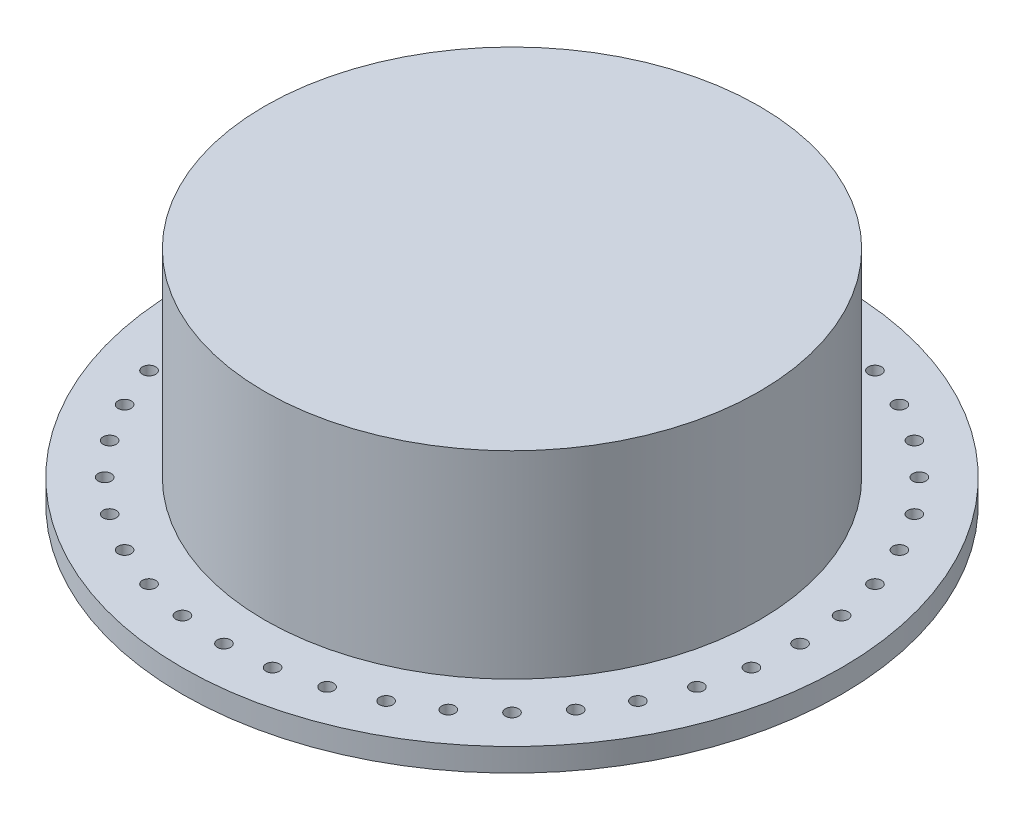
from build123d import *

# Parameters (mm, degrees)
SKIZZE1_R                       = 75
AUFSATZ_LINEAR_AUSTRAGEN1_DEPTH = 10
SKIZZE2_R                       = 100
AUFSATZ_LINEAR_AUSTRAGEN2_DEPTH = 7
SKIZZE3_R                       = 75
AUFSATZ_LINEAR_AUSTRAGEN3_DEPTH = 60
SKIZZE4_R                       = 2
SCHNITT_LINEAR_AUSTRAGEN1_DEPTH = 60


with BuildPart() as part:
    # Skizze1 → Aufsatz-Linear austragen1 (new body)
    with BuildSketch(Plane(origin=(0, 0, 0), x_dir=(1, 0, 0), z_dir=(0, 1, 0))):
        with Locations(Location((0, 0, 0), (0, 0, 270))):
            Circle(SKIZZE1_R)
    extrude(amount=AUFSATZ_LINEAR_AUSTRAGEN1_DEPTH)

    # Skizze2 → Aufsatz-Linear austragen2 (add)
    with BuildSketch(Plane(origin=(0, 10, 0), x_dir=(1, 0, 0), z_dir=(0, 1, 0))):
        with Locations(Location((0, 0, 0), (0, 0, 270))):
            Circle(SKIZZE2_R)
    extrude(amount=AUFSATZ_LINEAR_AUSTRAGEN2_DEPTH)

    # Skizze3 → Aufsatz-Linear austragen3 (add)
    with BuildSketch(Plane(origin=(0, 17, 0), x_dir=(1, 0, 0), z_dir=(0, 1, 0))):
        with Locations(Location((0, 0, 0), (0, 0, 270))):
            Circle(SKIZZE3_R)
    extrude(amount=AUFSATZ_LINEAR_AUSTRAGEN3_DEPTH)

    # Skizze4 → Schnitt-Linear austragen1 (cut)
    with BuildSketch(Plane(origin=(0, 17, 0), x_dir=(1, 0, 0), z_dir=(0, 1, 0))):
        with Locations(Location((0, 87.36395499, 0), (0, 0, 270))):
            Circle(SKIZZE4_R)
        with Locations(Location((13.666733563, 86.288359732, 0), (0, 0, 270))):
            Circle(SKIZZE4_R)
        with Locations(Location((26.996946788, 83.088058682, 0), (0, 0, 270))):
            Circle(SKIZZE4_R)
        with Locations(Location((39.662405585, 77.841853875, 0), (0, 0, 270))):
            Circle(SKIZZE4_R)
        with Locations(Location((51.351244325, 70.678924283, 0), (0, 0, 270))):
            Circle(SKIZZE4_R)
        with Locations(Location((61.775645005, 61.775645005, 0), (0, 0, 270))):
            Circle(SKIZZE4_R)
        with Locations(Location((70.678924283, 51.351244325, 0), (0, 0, 270))):
            Circle(SKIZZE4_R)
        with Locations(Location((77.841853875, 39.662405585, 0), (0, 0, 270))):
            Circle(SKIZZE4_R)
        with Locations(Location((83.088058682, 26.996946788, 0), (0, 0, 270))):
            Circle(SKIZZE4_R)
        with Locations(Location((86.288359732, 13.666733563, 0), (0, 0, 270))):
            Circle(SKIZZE4_R)
        with Locations(Location((87.36395499, 0, 0), (0, 0, 270))):
            Circle(SKIZZE4_R)
        with Locations(Location((86.288359732, -13.666733563, 0), (0, 0, 270))):
            Circle(SKIZZE4_R)
        with Locations(Location((83.088058682, -26.996946788, 0), (0, 0, 270))):
            Circle(SKIZZE4_R)
        with Locations(Location((77.841853875, -39.662405585, 0), (0, 0, 270))):
            Circle(SKIZZE4_R)
        with Locations(Location((70.678924283, -51.351244325, 0), (0, 0, 270))):
            Circle(SKIZZE4_R)
        with Locations(Location((61.775645005, -61.775645005, 0), (0, 0, 270))):
            Circle(SKIZZE4_R)
        with Locations(Location((51.351244325, -70.678924283, 0), (0, 0, 270))):
            Circle(SKIZZE4_R)
        with Locations(Location((39.662405585, -77.841853875, 0), (0, 0, 270))):
            Circle(SKIZZE4_R)
        with Locations(Location((26.996946788, -83.088058682, 0), (0, 0, 270))):
            Circle(SKIZZE4_R)
        with Locations(Location((13.666733563, -86.288359732, 0), (0, 0, 270))):
            Circle(SKIZZE4_R)
        with Locations(Location((0, -87.36395499, 0), (0, 0, 270))):
            Circle(SKIZZE4_R)
        with Locations(Location((-13.666733563, -86.288359732, 0), (0, 0, 270))):
            Circle(SKIZZE4_R)
        with Locations(Location((-26.996946788, -83.088058682, 0), (0, 0, 270))):
            Circle(SKIZZE4_R)
        with Locations(Location((-39.662405585, -77.841853875, 0), (0, 0, 270))):
            Circle(SKIZZE4_R)
        with Locations(Location((-51.351244325, -70.678924283, 0), (0, 0, 270))):
            Circle(SKIZZE4_R)
        with Locations(Location((-61.775645005, -61.775645005, 0), (0, 0, 270))):
            Circle(SKIZZE4_R)
        with Locations(Location((-70.678924283, -51.351244325, 0), (0, 0, 270))):
            Circle(SKIZZE4_R)
        with Locations(Location((-77.841853875, -39.662405585, 0), (0, 0, 270))):
            Circle(SKIZZE4_R)
        with Locations(Location((-83.088058682, -26.996946788, 0), (0, 0, 270))):
            Circle(SKIZZE4_R)
        with Locations(Location((-86.288359732, -13.666733563, 0), (0, 0, 270))):
            Circle(SKIZZE4_R)
        with Locations(Location((-87.36395499, 0, 0), (0, 0, 270))):
            Circle(SKIZZE4_R)
        with Locations(Location((-86.288359732, 13.666733563, 0), (0, 0, 270))):
            Circle(SKIZZE4_R)
        with Locations(Location((-83.088058682, 26.996946788, 0), (0, 0, 270))):
            Circle(SKIZZE4_R)
        with Locations(Location((-77.841853875, 39.662405585, 0), (0, 0, 270))):
            Circle(SKIZZE4_R)
        with Locations(Location((-70.678924283, 51.351244325, 0), (0, 0, 270))):
            Circle(SKIZZE4_R)
        with Locations(Location((-61.775645005, 61.775645005, 0), (0, 0, 270))):
            Circle(SKIZZE4_R)
        with Locations(Location((-51.351244325, 70.678924283, 0), (0, 0, 270))):
            Circle(SKIZZE4_R)
        with Locations(Location((-39.662405585, 77.841853875, 0), (0, 0, 270))):
            Circle(SKIZZE4_R)
        with Locations(Location((-26.996946788, 83.088058682, 0), (0, 0, 270))):
            Circle(SKIZZE4_R)
        with Locations(Location((-13.666733563, 86.288359732, 0), (0, 0, 270))):
            Circle(SKIZZE4_R)
    extrude(amount=-SCHNITT_LINEAR_AUSTRAGEN1_DEPTH, mode=Mode.SUBTRACT)


solid = part.part
